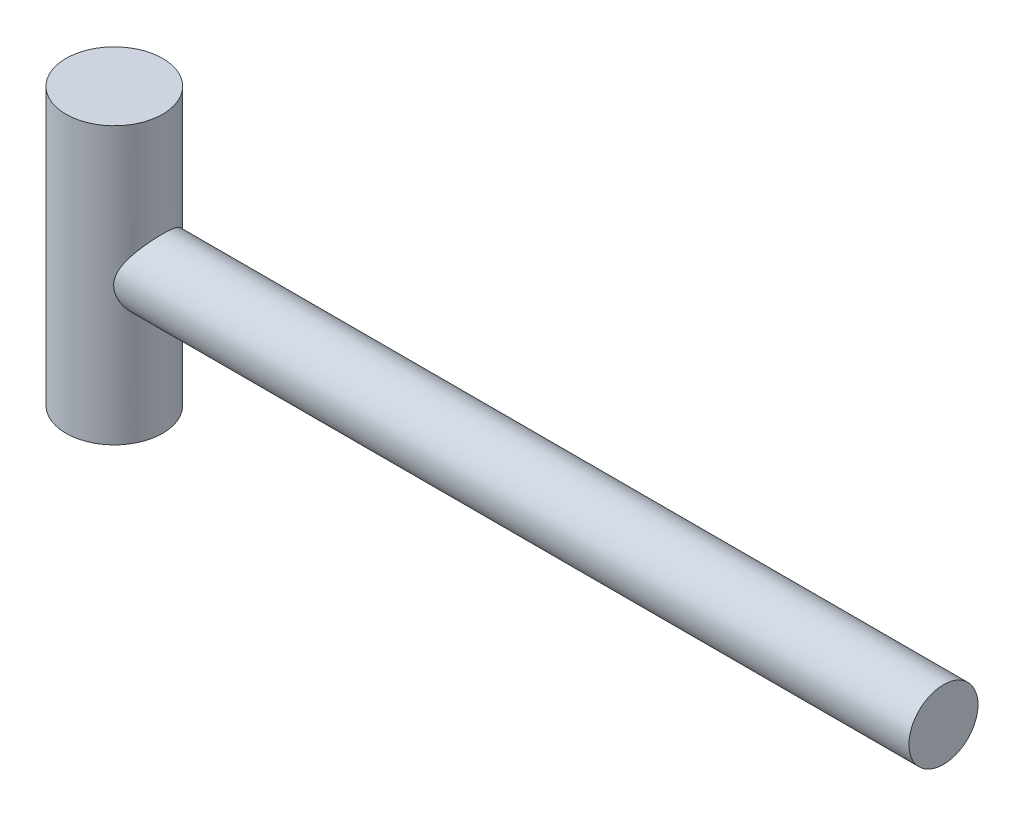
from build123d import *

# Parameters (mm, degrees)
SKETCH3_R           = 1.75
BOSS_EXTRUDE1_DEPTH = 5
SKETCH4_R           = 1.25
BOSS_EXTRUDE2_DEPTH = 30


with BuildPart() as part:
    # Sketch3 → Boss-Extrude1 (new, symmetric)
    with BuildSketch(Plane(origin=(0, 0, 0), x_dir=(1, 0, 0), z_dir=(0, 1, 0))):
        with Locations(Location((0, 0, 0), (0, 0, 270))):
            Circle(SKETCH3_R)
    extrude(amount=BOSS_EXTRUDE1_DEPTH, both=True)

    # Sketch4 → Boss-Extrude2 (add)
    with BuildSketch(Plane(origin=(0, 0, 0), x_dir=(0, 0, -1), z_dir=(1, 0, 0))):
        with Locations(Location((0, 0, 0), (0, 0, 180))):
            Circle(SKETCH4_R)
    extrude(amount=BOSS_EXTRUDE2_DEPTH)


solid = part.part
